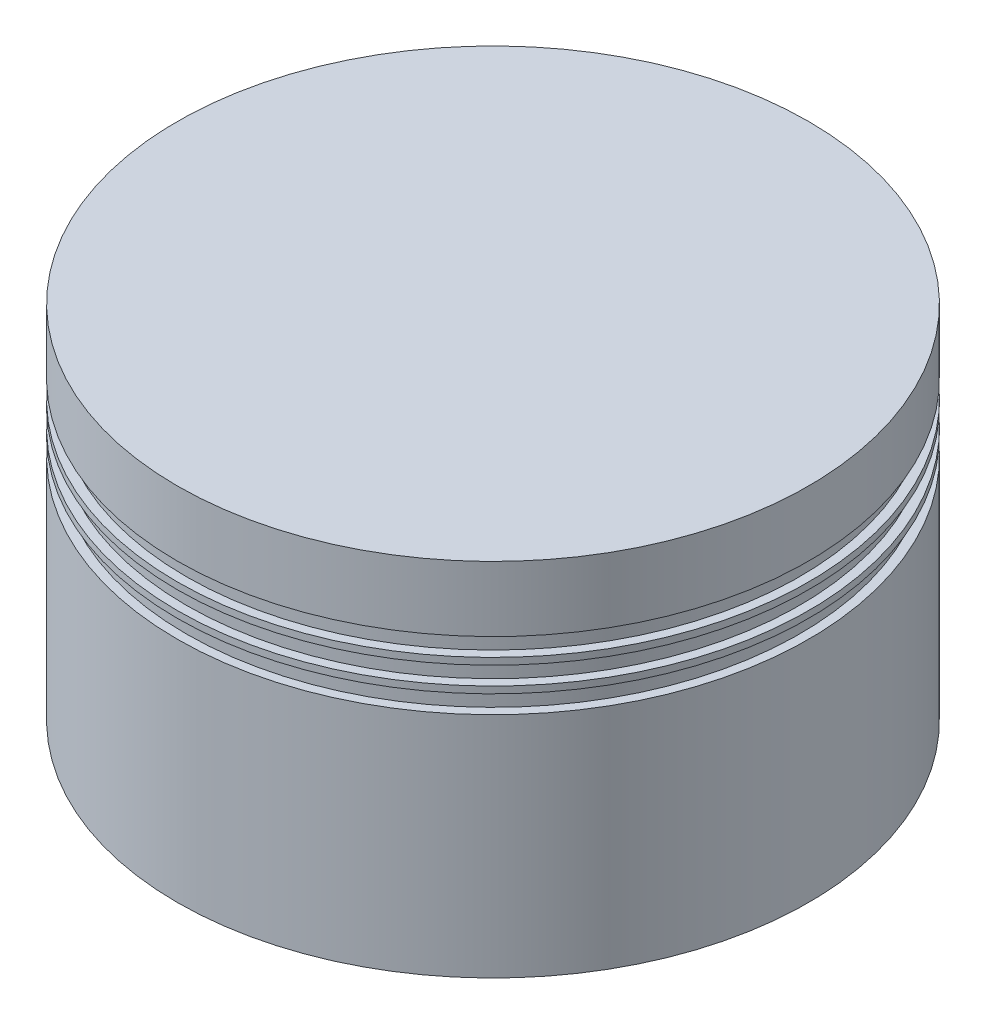
from build123d import *


with BuildPart() as part:
    # Sketch1 → Revolve1 (revolve)
    with BuildSketch(Plane.XY, mode=Mode.PRIVATE) as revolve1_sk:
        Polygon((0, 0), (140, 0), (140, -28.863803247), (136, -28.863803247), (136, -36.863803247), (140, -36.863803247), (140, -39.863803247), (136, -39.863803247), (136, -47.863803247), (140, -47.863803247), (140, -50.863803247), (136, -50.863803247), (136, -58.863803247), (140, -58.863803247), (140, -160), (130, -160), (130, -10), (0, -10), align=None)
    revolve(revolve1_sk.sketch.rotate(Axis((0, 0, 0), (0, -1, 0)), 90), axis=Axis((0, 0, 0), (0, -1, 0)))

    # Sketch2 → Revolve2 (revolve)
    with BuildSketch(Plane.XY, mode=Mode.PRIVATE) as revolve2_sk:
        with BuildLine():
            Line((0, 0), (0, -140))
            ThreePointArc((0, -140), (7.071067812, -142.928932188), (10, -150))
            Line((10, -150), (24, -150))
            Line((24, -150), (24, 0))
            Line((24, 0), (0, 0))
        make_face()
    revolve(revolve2_sk.sketch.rotate(Axis((0, 0, 0), (0, -1, 0)), 180), axis=Axis((0, 0, 0), (0, -1, 0)))


solid = part.part
